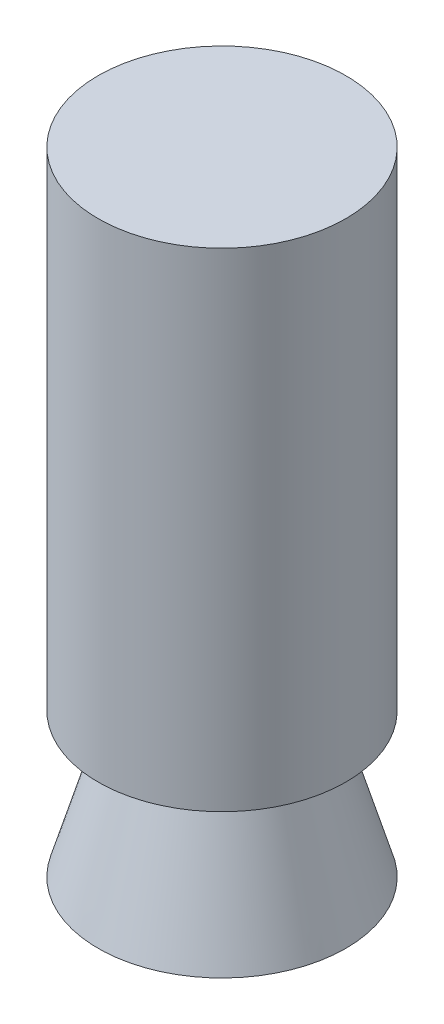
from build123d import *


with BuildPart() as part:
    # Esquisse1 → Révolution1 (revolve)
    with BuildSketch(Plane.XY):
        Polygon((-6.63246603, 74.857346398), (-45.63246603, 74.857346398), (-45.63246603, -98.179299131), (-25.446506602, -98.179299131), (-42.255365298, -155.142653602), (-45.20618497, -165.142653602), (-55.63246603, -165.142653602), (-38.823607333, -108.179299131), (-55.63246603, -108.179299131), (-55.63246603, 84.857346398), (-6.63246603, 84.857346398), align=None)
    revolve(axis=Axis((-6.63246603, 84.857346398, 0), (0, -1, 0)))


solid = part.part
